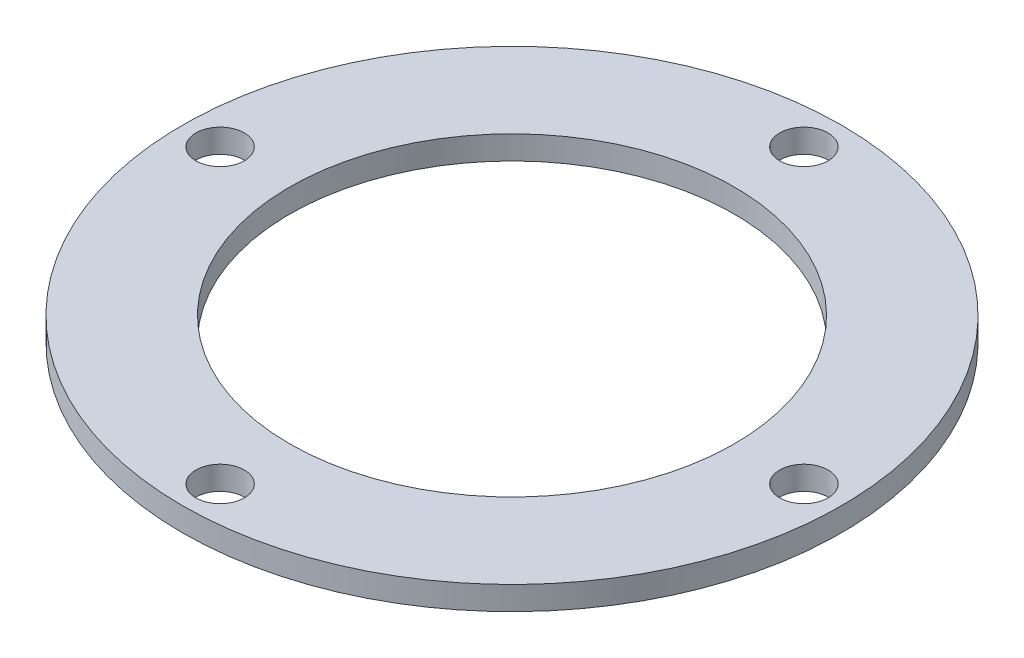
from build123d import *

# Parameters (mm, degrees)
SKETCH1_R           = 44.45
SKETCH1_R_2         = 30
SKETCH1_R_3         = 3.2639
BOSS_EXTRUDE1_DEPTH = 3.175


with BuildPart() as part:
    # Sketch1 → Boss-Extrude1 (new body)
    with BuildSketch(Plane(origin=(0, 0, 0), x_dir=(1, 0, 0), z_dir=(0, 1, 0))):
        with Locations(Location((0, 0, 0), (0, 0, 270))):
            Circle(SKETCH1_R)
        with Locations(Location((0, 0, 0), (0, 0, 270))):
            Circle(SKETCH1_R_2, mode=Mode.SUBTRACT)
        with Locations(Location((0, 39.37, 0), (0, 0, 270))):
            Circle(SKETCH1_R_3, mode=Mode.SUBTRACT)
        with Locations(Location((39.37, 0, 0), (0, 0, 270))):
            Circle(SKETCH1_R_3, mode=Mode.SUBTRACT)
        with Locations(Location((0, -39.37, 0), (0, 0, 270))):
            Circle(SKETCH1_R_3, mode=Mode.SUBTRACT)
        with Locations(Location((-39.37, 0, 0), (0, 0, 270))):
            Circle(SKETCH1_R_3, mode=Mode.SUBTRACT)
    extrude(amount=BOSS_EXTRUDE1_DEPTH)


solid = part.part
